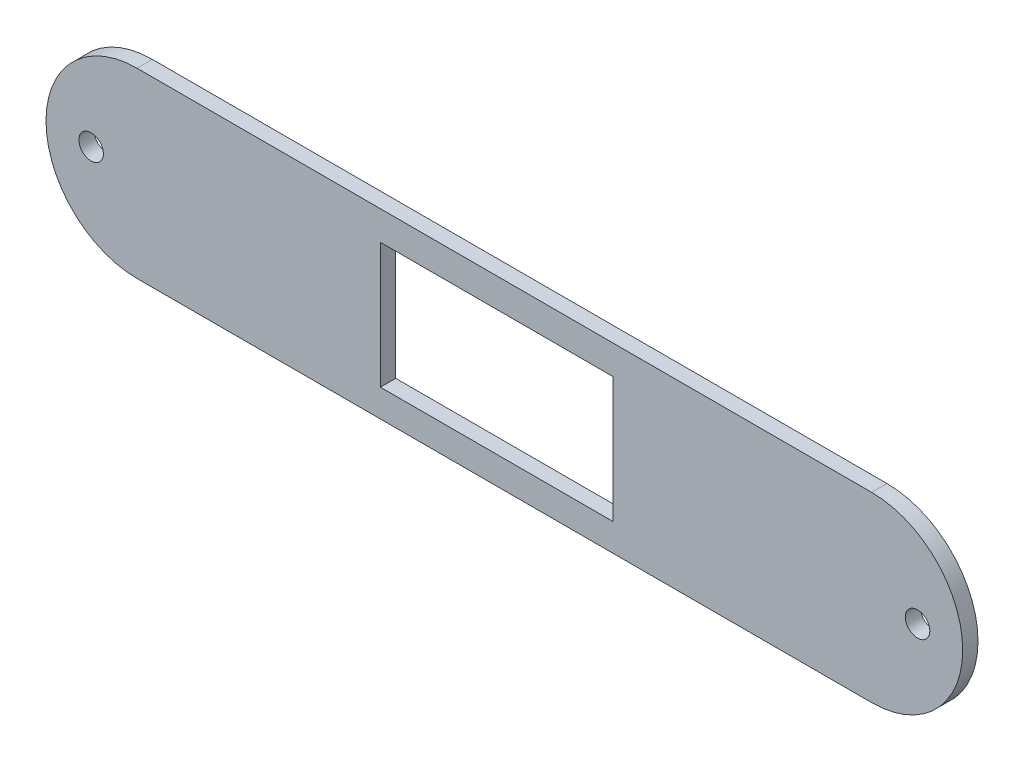
from build123d import *

# Parameters (mm, degrees)
BOSS_EXTRUDE2_DEPTH = 1
SKETCH4_R           = 0.8
CUT_EXTRUDE1_DEPTH  = 31.551677532
SKETCH5_W           = 15.2
SKETCH5_H           = 8.2
CUT_EXTRUDE2_DEPTH  = 31.551677532


with BuildPart() as part:
    # Sketch3 → Boss-Extrude2 (new body)
    with BuildSketch(Plane.XY):
        with BuildLine():
            Line((24, 5.95), (-24, 5.95))
            ThreePointArc((-24, 5.95), (-29.95, 0), (-24, -5.95))
            Line((-24, -5.95), (24, -5.95))
            ThreePointArc((24, -5.95), (29.95, 0), (24, 5.95))
        make_face()
    extrude(amount=BOSS_EXTRUDE2_DEPTH)

    # Sketch4 → Cut-Extrude1 (cut, through all)
    with BuildSketch(Plane.XY.offset(1)):
        with Locations((-27, 0)):
            Circle(SKETCH4_R)
        with Locations((27, 0)):
            Circle(SKETCH4_R)
    extrude(amount=-CUT_EXTRUDE1_DEPTH, mode=Mode.SUBTRACT)

    # Sketch5 → Cut-Extrude2 (cut, through all)
    with BuildSketch(Plane.XY.offset(1)):
        with Locations((-0.5, -0.05)):
            Rectangle(SKETCH5_W, SKETCH5_H)
    extrude(amount=-CUT_EXTRUDE2_DEPTH, mode=Mode.SUBTRACT)


solid = part.part
